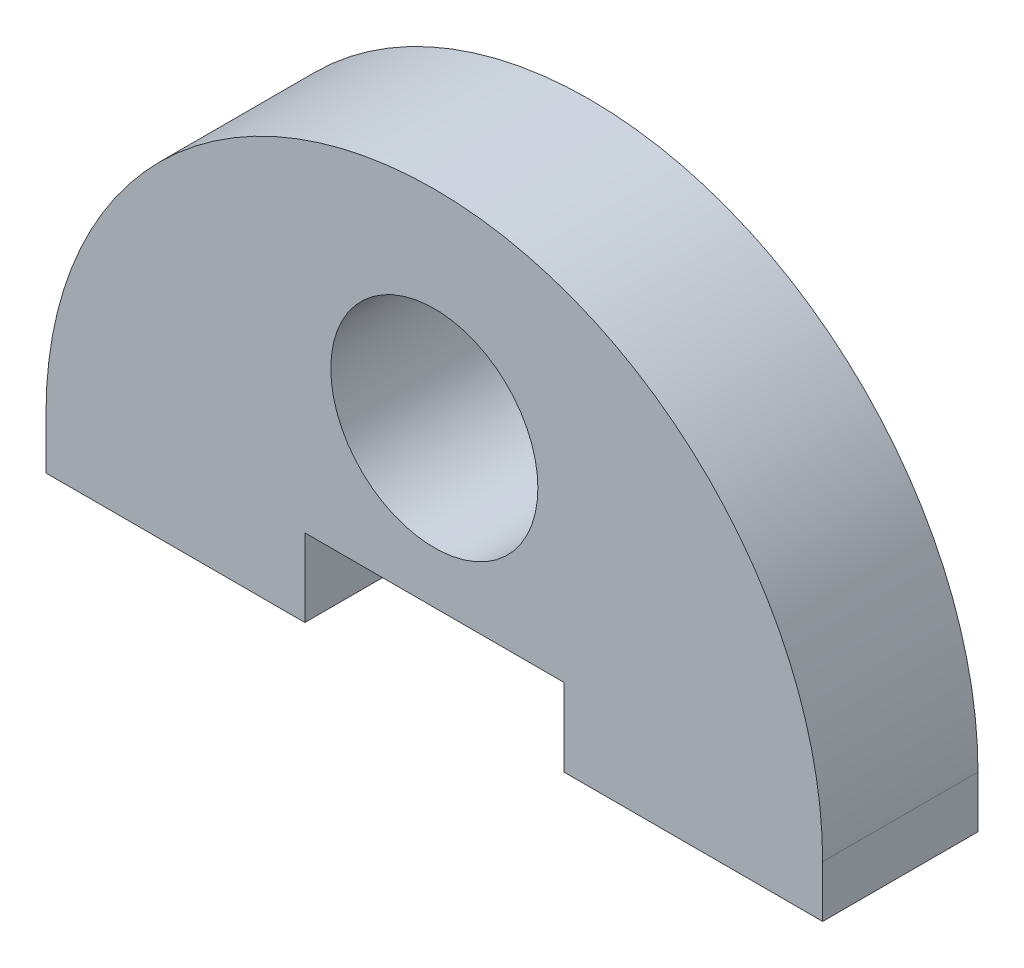
from build123d import *

# Parameters (mm, degrees)
SKETCH1_R           = 4
BOSS_EXTRUDE1_DEPTH = 6


with BuildPart() as part:
    # Sketch1 → Boss-Extrude1 (new body)
    with BuildSketch(Plane.XY):
        with BuildLine():
            Line((0, 0), (10, 0))
            Line((10, 0), (10, 3))
            Line((10, 3), (20, 3))
            Line((20, 3), (20, 0))
            Line((20, 0), (30, 0))
            Line((30, 0), (30, 2))
            ThreePointArc((30, 2), (15, 17), (0, 2))
            Line((0, 2), (0, 0))
        make_face()
        with Locations((15, 9)):
            Circle(SKETCH1_R, mode=Mode.SUBTRACT)
    extrude(amount=BOSS_EXTRUDE1_DEPTH)


solid = part.part
